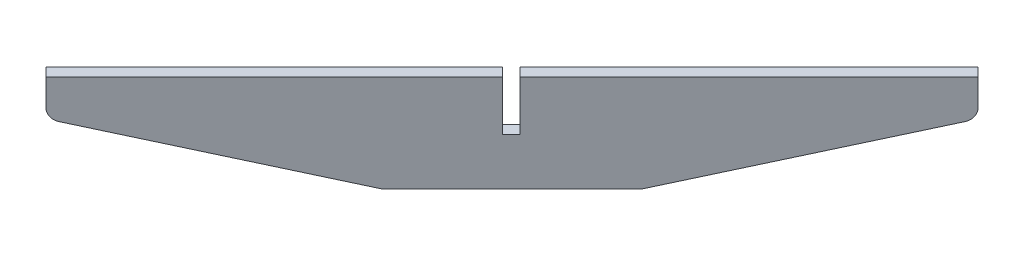
from build123d import *

# Parameters (mm, degrees)
BOSS_EXTRUDE1_DEPTH     = 15
BOSS_EXTRUDE2_DEPTH     = 5
CUT_EXTRUDE2_DEPTH      = 284.32843133
CUT_EXTRUDE2_DEPTH_BACK = 284.32843133
SKETCH4_W               = 10.2
SKETCH4_H               = 82
FILLET1_R               = 10


with BuildPart() as part:
    # Sketch1 → Boss-Extrude1 (new, symmetric)
    with BuildSketch(Plane(origin=(0, 0, 0), x_dir=(1, 0, 0), z_dir=(0, 1, 0))):
        Polygon((-195, -187.928932188), (-187.928932188, -195), (195, 187.928932188), (187.928932188, 195), align=None)
    extrude(amount=BOSS_EXTRUDE1_DEPTH, both=True)

    # Sketch3 → Boss-Extrude2 (add, symmetric)
    with BuildSketch(Plane(origin=(0, 0, 0), x_dir=(0.7071067811865476, 0, -0.7071067811865476), z_dir=(0.7071067811865476, 0, 0.7071067811865476))):
        Polygon((270.771644663, -15), (75, -65), (-75, -65), (-270.771644663, -15), align=None)
    extrude(amount=BOSS_EXTRUDE2_DEPTH, both=True)

    # Sketch4 → Cut-Extrude2 (cut, two sides: drawn at the far end of the back side and taken through both)
    with BuildSketch(Plane(origin=(0, 0, 0), x_dir=(0.7071067811865476, 0, -0.7071067811865476), z_dir=(0.7071067811865476, 0, 0.7071067811865476)).offset(-CUT_EXTRUDE2_DEPTH_BACK)):
        with Locations((-0.430935361, 15)):
            Rectangle(SKETCH4_W, SKETCH4_H)
    extrude(amount=CUT_EXTRUDE2_DEPTH + CUT_EXTRUDE2_DEPTH_BACK, mode=Mode.SUBTRACT)

    # Fillet1
    fillet1_edges = [part.edges().sort_by_distance(p)[0] for p in [
        (191.464466094, -15, -191.464466094),
        (-191.464466094, -15, 191.464466094),
    ]]
    fillet(fillet1_edges, radius=FILLET1_R)


solid = part.part
